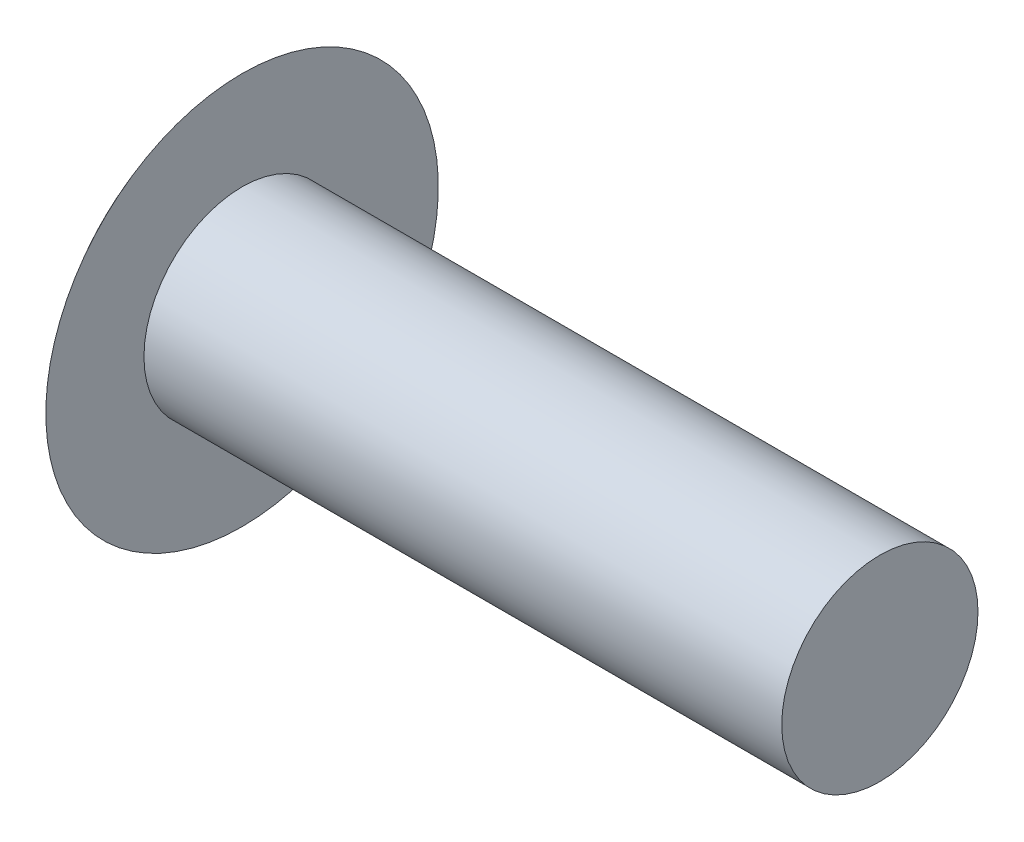
from build123d import *

# Parameters (mm, degrees)
SKETCH1_R           = 2
BOSS_EXTRUDE1_DEPTH = 13


with BuildPart() as part:
    # Sketch1 → Boss-Extrude1 (new body)
    with BuildSketch(Plane(origin=(0, 0, 0), x_dir=(0, 0, -1), z_dir=(1, 0, 0))):
        with Locations(Location((0, 0, 0), (0, 0, 180))):
            Circle(SKETCH1_R)
    extrude(amount=BOSS_EXTRUDE1_DEPTH)

    # Sketch2 → Revolve1 (revolve)
    with BuildSketch(Plane.XY):
        with BuildLine():
            Line((0, 0), (0, 4))
            ThreePointArc((0, 4), (-1.008502354, 2.11195459), (-1.356985174, 0))
            Line((-1.356985174, 0), (0, 0))
        make_face()
    revolve(axis=Axis((-1.356985174, 0, 0), (1, 0, 0)))


solid = part.part
